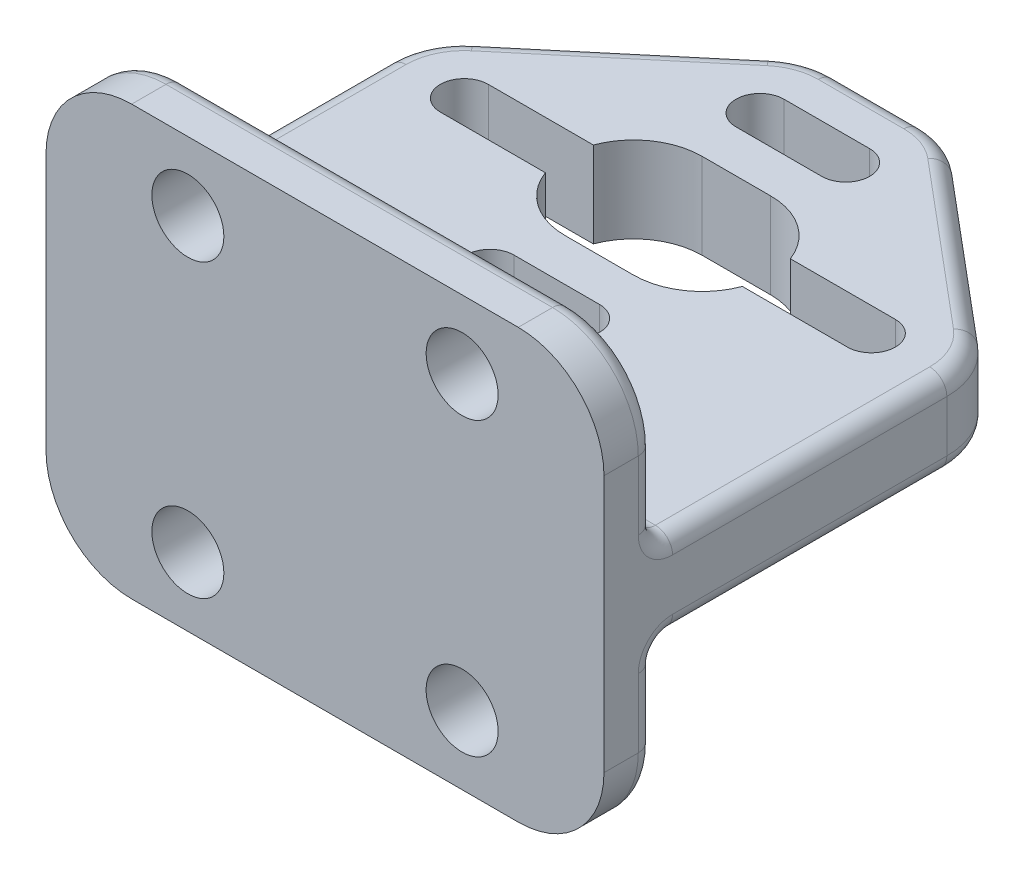
from build123d import *

# Parameters (mm, degrees)
BOSS_EXTRUDE1_DEPTH      = 5
CUT_EXTRUDE1_DEPTH       = 23.982085415
BOSS_EXTRUDE3_START      = -5
BOSS_EXTRUDE3_DEPTH      = 5
BOSS_EXTRUDE4_DEPTH      = 10
BOSS_EXTRUDE4_DEPTH_BACK = 15
SKETCH5_W                = 32.55
SKETCH5_H                = 3
SKETCH6_R                = 2.1
CUT_EXTRUDE2_DEPTH       = 10
FILLET1_R                = 5
FILLET2_R                = 1


with BuildPart() as part:
    # Sketch1 → Boss-Extrude1 (new body)
    with BuildSketch(Plane(origin=(0, 0, 0), x_dir=(1, 0, 0), z_dir=(0, 1, 0))):
        with BuildLine():
            Line((0, 12.275), (5, 12.275))
            ThreePointArc((5, 12.275), (6.505980381, 12.009250003), (7.83004518, 11.244101405))
            Line((7.83004518, 11.244101405), (17.20504518, 3.369101405))
            ThreePointArc((17.20504518, 3.369101405), (18.775, 0), (17.20504518, -3.369101405))
            Line((17.20504518, -3.369101405), (7.83004518, -11.244101405))
            ThreePointArc((7.83004518, -11.244101405), (6.505980381, -12.009250003), (5, -12.275))
            Line((5, -12.275), (0, -12.275))
            ThreePointArc((0, -12.275), (-1.505980381, -12.009250003), (-2.83004518, -11.244101405))
            Line((-2.83004518, -11.244101405), (-12.20504518, -3.369101405))
            ThreePointArc((-12.20504518, -3.369101405), (-13.775, 0), (-12.20504518, 3.369101405))
            Line((-12.20504518, 3.369101405), (-2.83004518, 11.244101405))
            ThreePointArc((-2.83004518, 11.244101405), (-1.505980381, 12.009250003), (0, 12.275))
        make_face()
        with BuildLine():
            Line((-9.375, 1.4), (14.375, 1.4))
            ThreePointArc((14.375, 1.4), (15.775, 0), (14.375, -1.4))
            Line((14.375, -1.4), (-9.375, -1.4))
            ThreePointArc((-9.375, -1.4), (-10.775, 0), (-9.375, 1.4))
        make_face(mode=Mode.SUBTRACT)
        with BuildLine():
            Line((0, 9.275), (5, 9.275))
            ThreePointArc((5, 9.275), (6.4, 7.875), (5, 6.475))
            Line((5, 6.475), (0, 6.475))
            ThreePointArc((0, 6.475), (-1.4, 7.875), (0, 9.275))
        make_face(mode=Mode.SUBTRACT)
        with BuildLine():
            Line((0, -6.475), (5, -6.475))
            ThreePointArc((5, -6.475), (6.4, -7.875), (5, -9.275))
            Line((5, -9.275), (0, -9.275))
            ThreePointArc((0, -9.275), (-1.4, -7.875), (0, -6.475))
        make_face(mode=Mode.SUBTRACT)
    extrude(amount=BOSS_EXTRUDE1_DEPTH)

    # Sketch2 → Cut-Extrude1 (cut, through all)
    with BuildSketch(Plane(origin=(0, 5, 0), x_dir=(1, 0, 0), z_dir=(0, 1, 0))):
        with BuildLine():
            Line((0.5, 4), (4.5, 4))
            ThreePointArc((4.5, 4), (8.5, 0), (4.5, -4))
            Line((4.5, -4), (0.5, -4))
            ThreePointArc((0.5, -4), (-3.5, 0), (0.5, 4))
        make_face()
    extrude(amount=-CUT_EXTRUDE1_DEPTH, mode=Mode.SUBTRACT)

    # Sketch4 → Boss-Extrude3 (add)
    with BuildSketch(Plane(origin=(0, 5, 0), x_dir=(1, 0, 0), z_dir=(0, 1, 0)).offset(BOSS_EXTRUDE3_START)):
        with BuildLine():
            Line((-13.775, 0), (-13.775, -20))
            Line((-13.775, -20), (18.775, -20))
            Line((18.775, -20), (18.775, 0))
            ThreePointArc((18.775, 0), (18.363245153, -1.858467273), (17.20504518, -3.369101405))
            Line((17.20504518, -3.369101405), (7.83004518, -11.244101405))
            ThreePointArc((7.83004518, -11.244101405), (6.505980381, -12.009250003), (5, -12.275))
            Line((5, -12.275), (0, -12.275))
            ThreePointArc((0, -12.275), (-1.505980381, -12.009250003), (-2.83004518, -11.244101405))
            Line((-2.83004518, -11.244101405), (-12.20504518, -3.369101405))
            ThreePointArc((-12.20504518, -3.369101405), (-13.363245153, -1.858467273), (-13.775, 0))
        make_face()
    extrude(amount=BOSS_EXTRUDE3_DEPTH)

    # Sketch5 → Boss-Extrude4 (add, two sides: drawn at the far end of the back side and taken through both)
    with BuildSketch(Plane(origin=(0, 5, 0), x_dir=(1, 0, 0), z_dir=(0, 1, 0)).offset(-BOSS_EXTRUDE4_DEPTH_BACK)):
        with Locations((2.5, -18.5)):
            Rectangle(SKETCH5_W, SKETCH5_H)
    extrude(amount=BOSS_EXTRUDE4_DEPTH + BOSS_EXTRUDE4_DEPTH_BACK)

    # Sketch6 → Cut-Extrude2 (cut)
    with BuildSketch(Plane(origin=(0, 0, 17), x_dir=(-1, 0, 0), z_dir=(0, 0, -1))):
        with Locations((-10.5, 11)):
            Circle(SKETCH6_R)
        with Locations((5.5, 11)):
            Circle(SKETCH6_R)
        with Locations(Location((5.5, -6, 0), (0, 0, 180))):
            Circle(SKETCH6_R)
        with Locations(Location((-10.5, -6, 0), (0, 0, 180))):
            Circle(SKETCH6_R)
    extrude(amount=-CUT_EXTRUDE2_DEPTH, mode=Mode.SUBTRACT)

    # Fillet1
    fillet1_edges = [part.edges().sort_by_distance(p)[0] for p in [
        (-13.775, -10, 18.5),
        (18.775, -10, 18.5),
        (-13.775, 15, 18.5),
        (18.775, 15, 18.5),
    ]]
    fillet(fillet1_edges, radius=FILLET1_R)

    # Fillet2
    fillet2_edges = [part.edges().sort_by_distance(p)[0] for p in [
        (18.363245153, 0, -1.858467273),
        (18.363245153, 5, -1.858467273),
        (-13.775, 0, 8.5),
        (-13.775, 5, 8.5),
        (2.5, 0, -12.275),
        (6.505980381, 0, -12.009250003),
        (-13.363245153, 5, -1.858467273),
        (12.51754518, 0, -7.306601405),
        (18.775, 5, 8.5),
        (18.775, 0, 8.5),
        (2.5, 0, 17),
        (2.5, 5, 17),
        (-13.775, 7.5, 17),
        (18.775, 7.5, 17),
        (-13.363245153, 0, -1.858467273),
        (-7.51754518, 0, -7.306601405),
        (-1.505980381, 0, -12.009250003),
        (18.775, -2.5, 17),
        (2.5, -10, 17),
        (-13.775, -2.5, 17),
        (-12.310533906, -8.535533906, 17),
        (17.310533906, -8.535533906, 17),
        (2.5, 15, 17),
        (-12.310533906, 13.535533906, 17),
        (17.310533906, 13.535533906, 17),
        (12.51754518, 5, -7.306601405),
        (6.505980381, 5, -12.009250003),
        (2.5, 5, -12.275),
        (-1.505980381, 5, -12.009250003),
        (-7.51754518, 5, -7.306601405),
    ]]
    fillet(fillet2_edges, radius=FILLET2_R)


solid = part.part
